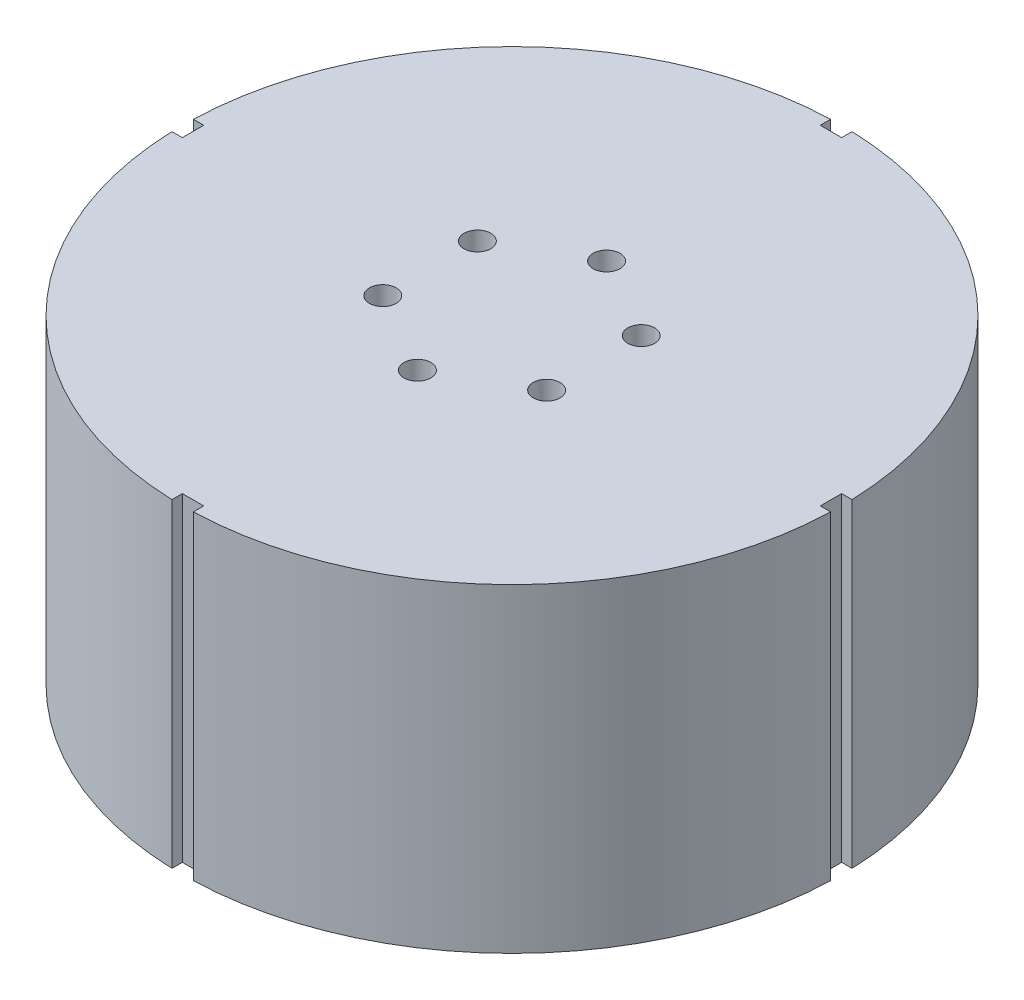
from build123d import *

# Parameters (mm, degrees)
BOSS_EXTRUDE1_DEPTH = 52.34
SKETCH2_R           = 2.2
CUT_EXTRUDE1_DEPTH  = 80
SKETCH3_R           = 49.6
CUT_EXTRUDE2_DEPTH  = 30


with BuildPart() as part:
    # Sketch1 → Boss-Extrude1 (new body)
    with BuildSketch(Plane(origin=(0, 0, 0), x_dir=(1, 0, 0), z_dir=(0, 1, 0))):
        with BuildLine():
            ThreePointArc((-53.971636069, -1.75), (-38.183766184, -38.183766184), (-1.75, -53.971636069))
            Line((-1.75, -53.971636069), (-1.75, -52.271636069))
            Line((-1.75, -52.271636069), (1.75, -52.271636069))
            Line((1.75, -52.271636069), (1.75, -53.971636069))
            ThreePointArc((1.75, -53.971636069), (38.183766184, -38.183766184), (53.971636069, -1.75))
            Line((53.971636069, -1.75), (52.271636069, -1.75))
            Line((52.271636069, -1.75), (52.271636069, 1.75))
            Line((52.271636069, 1.75), (53.971636069, 1.75))
            ThreePointArc((53.971636069, 1.75), (38.183766184, 38.183766184), (1.75, 53.971636069))
            Line((1.75, 53.971636069), (1.75, 52.271636069))
            Line((1.75, 52.271636069), (-1.75, 52.271636069))
            Line((-1.75, 52.271636069), (-1.75, 53.971636069))
            ThreePointArc((-1.75, 53.971636069), (-38.183766184, 38.183766184), (-53.971636069, 1.75))
            Line((-53.971636069, 1.75), (-52.271636069, 1.75))
            Line((-52.271636069, 1.75), (-52.271636069, -1.75))
            Line((-52.271636069, -1.75), (-53.971636069, -1.75))
        make_face()
    extrude(amount=BOSS_EXTRUDE1_DEPTH)

    # Sketch2 → Cut-Extrude1 (cut)
    with BuildSketch(Plane.XZ):
        with Locations(Location((0, 15.5, 0), (0, 0, 270))):
            Circle(SKETCH2_R)
        with Locations(Location((13.423393759, 7.75, 0), (0, 0, 270))):
            Circle(SKETCH2_R)
        with Locations(Location((13.423393759, -7.75, 0), (0, 0, 270))):
            Circle(SKETCH2_R)
        with Locations(Location((0, -15.5, 0), (0, 0, 270))):
            Circle(SKETCH2_R)
        with Locations(Location((-13.423393759, -7.75, 0), (0, 0, 270))):
            Circle(SKETCH2_R)
        with Locations(Location((-13.423393759, 7.75, 0), (0, 0, 270))):
            Circle(SKETCH2_R)
    extrude(amount=-CUT_EXTRUDE1_DEPTH, mode=Mode.SUBTRACT)

    # Sketch3 → Cut-Extrude2 (cut)
    with BuildSketch(Plane.XZ):
        with Locations(Location((0, 0, 0), (0, 0, 270))):
            Circle(SKETCH3_R)
    extrude(amount=-CUT_EXTRUDE2_DEPTH, mode=Mode.SUBTRACT)


solid = part.part
